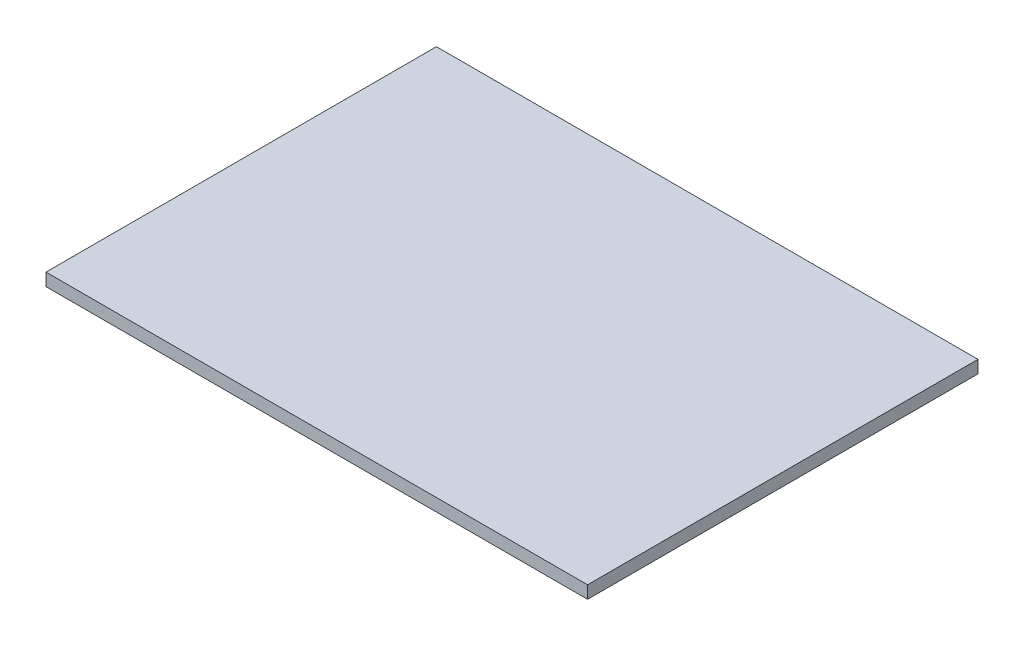
from build123d import *

# Parameters (mm, degrees)
SKETCH_1_W      = 215
SKETCH_1_H      = 155
EXTRUDE_1_DEPTH = 5


with BuildPart() as part:
    # 스케치1 → 보스-돌출1 (new body)
    with BuildSketch(Plane(origin=(0, 0, 0), x_dir=(1, 0, 0), z_dir=(0, 1, 0))):
        Rectangle(SKETCH_1_W, SKETCH_1_H)
    extrude(amount=EXTRUDE_1_DEPTH)


solid = part.part
